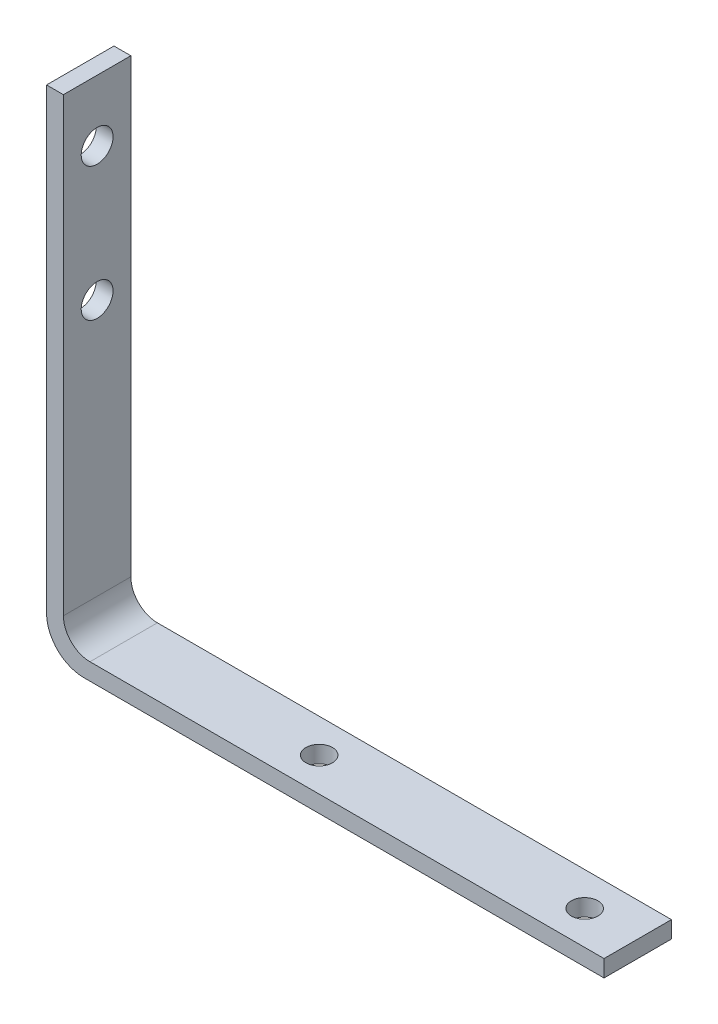
from build123d import *

# Parameters (mm, degrees)
SKETCH1_W           = 105
SKETCH1_H           = 12.7
SKETCH1_R           = 2.5
BOSS_EXTRUDE1_DEPTH = 3.175
SKETCH2_W           = 3.175
SKETCH2_H           = 12.7
BOSS_EXTRUDE2_DEPTH = 90
SKETCH3_R           = 3
CUT_EXTRUDE1_DEPTH  = 3.175
FILLET1_R           = 5
FILLET2_R           = 7


with BuildPart() as part:
    # Sketch1 → Boss-Extrude1 (new body)
    with BuildSketch(Plane(origin=(0, 0, 0), x_dir=(1, 0, 0), z_dir=(0, 1, 0))):
        Rectangle(SKETCH1_W, SKETCH1_H)
        with Locations(Location((42.5, 0, 0), (0, 0, 270))):
            Circle(SKETCH1_R, mode=Mode.SUBTRACT)
        with Locations(Location((-7.5, 0, 0), (0, 0, 270))):
            Circle(SKETCH1_R, mode=Mode.SUBTRACT)
    extrude(amount=BOSS_EXTRUDE1_DEPTH)

    # Sketch2 → Boss-Extrude2 (add)
    with BuildSketch(Plane(origin=(0, 3.175, 0), x_dir=(1, 0, 0), z_dir=(0, 1, 0))):
        with Locations((-50.9125, 0)):
            Rectangle(SKETCH2_W, SKETCH2_H)
    extrude(amount=BOSS_EXTRUDE2_DEPTH)

    # Sketch3 → Cut-Extrude1 (cut)
    with BuildSketch(Plane.ZY.offset(52.5)):
        with Locations((0, 56.51)):
            Circle(SKETCH3_R)
        with Locations((0, 81.656)):
            Circle(SKETCH3_R)
    extrude(amount=-CUT_EXTRUDE1_DEPTH, mode=Mode.SUBTRACT)

    # Fillet1
    fillet1_edges = [part.edges().sort_by_distance(p)[0] for p in [
        (-49.325, 3.175, 0),
    ]]
    fillet(fillet1_edges, radius=FILLET1_R)

    # Fillet2
    fillet2_edges = [part.edges().sort_by_distance(p)[0] for p in [
        (-52.5, 0, 0),
    ]]
    fillet(fillet2_edges, radius=FILLET2_R)


solid = part.part
